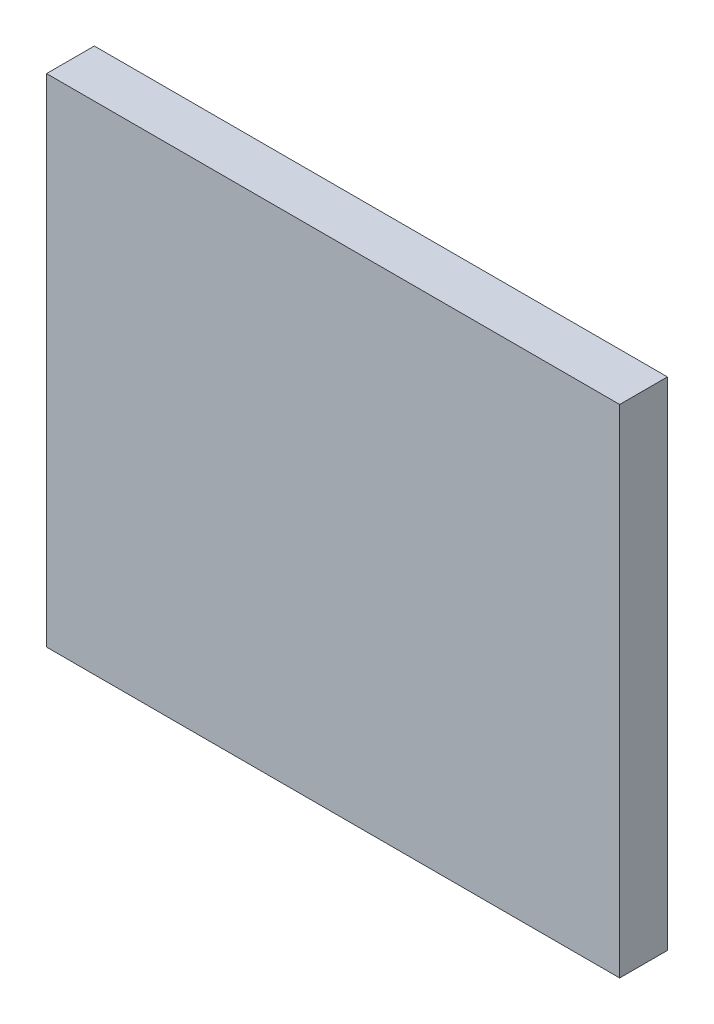
from build123d import *

# Parameters (mm, degrees)
SKETCH_1_W      = 60
SKETCH_1_H      = 52
EXTRUDE_1_DEPTH = 5


with BuildPart() as part:
    # 스케치1 → 보스-돌출1 (new body)
    with BuildSketch(Plane.XY):
        Rectangle(SKETCH_1_W, SKETCH_1_H)
    extrude(amount=EXTRUDE_1_DEPTH)


solid = part.part
